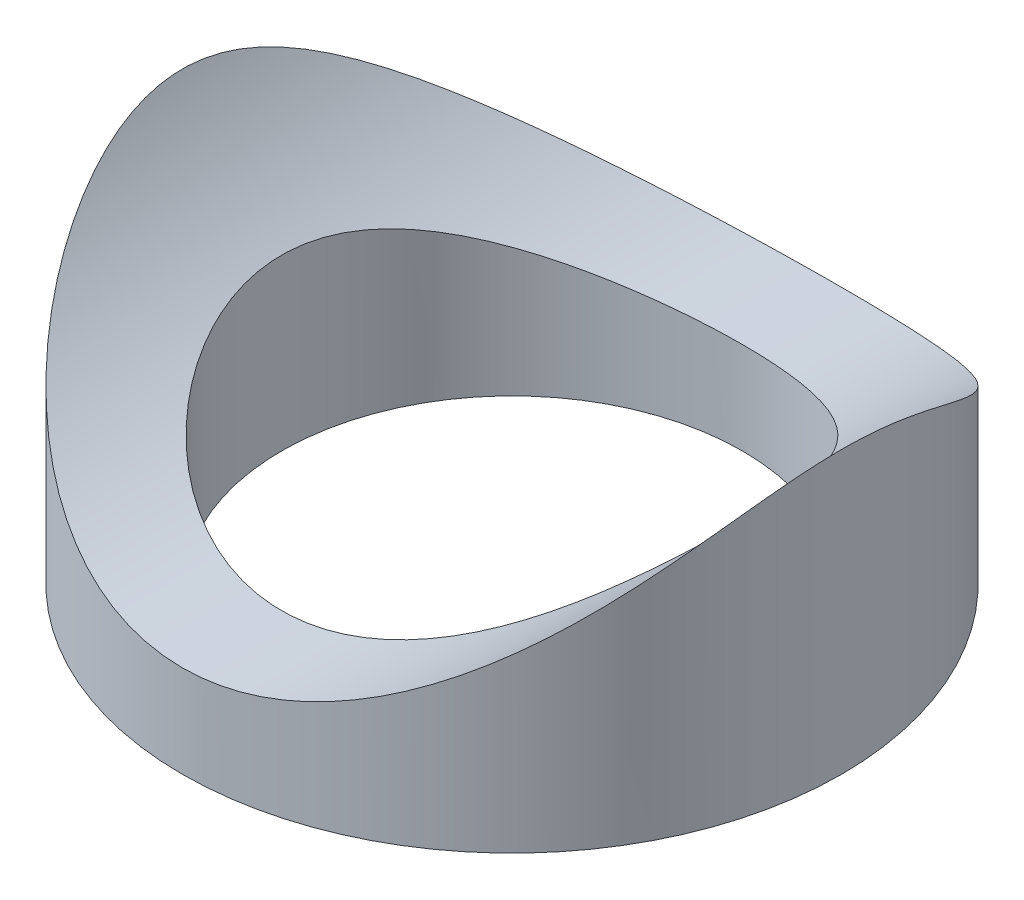
from build123d import *

# Parameters (mm, degrees)
SKETCH1_R               = 7.15
SKETCH1_R_2             = 5
BOSS_EXTRUDE1_DEPTH     = 10
CUT_EXTRUDE1_DEPTH      = 15.221286862
CUT_EXTRUDE1_DEPTH_BACK = 15.221286862
SKETCH2_R               = 8.28
BOSS_EXTRUDE2_START     = 1
SKETCH3_R               = 7.15
SKETCH3_R_2             = 5
BOSS_EXTRUDE2_DEPTH     = 1


with BuildPart() as part:
    # Sketch1 → Boss-Extrude1 (new body)
    with BuildSketch(Plane(origin=(0, 0, 0), x_dir=(1, 0, 0), z_dir=(0, 1, 0))):
        with Locations(Location((0, 0, 0), (0, 0, 270))):
            Circle(SKETCH1_R)
        with Locations(Location((0, 0, 0), (0, 0, 270))):
            Circle(SKETCH1_R_2, mode=Mode.SUBTRACT)
    extrude(amount=BOSS_EXTRUDE1_DEPTH)

    # Sketch2 → Cut-Extrude1 (cut, two sides: drawn at the far end of the back side and taken through both)
    with BuildSketch(Plane.XY.offset(-CUT_EXTRUDE1_DEPTH_BACK)):
        with Locations((0, 9.28)):
            Circle(SKETCH2_R)
    extrude(amount=CUT_EXTRUDE1_DEPTH + CUT_EXTRUDE1_DEPTH_BACK, mode=Mode.SUBTRACT)

    # Sketch3 → Boss-Extrude2 (add)
    with BuildSketch(Plane.XZ.offset(BOSS_EXTRUDE2_START)):
        with Locations(Location((0, 0, 0), (0, 0, 270))):
            Circle(SKETCH3_R)
        with Locations(Location((0, 0, 0), (0, 0, 270))):
            Circle(SKETCH3_R_2, mode=Mode.SUBTRACT)
    extrude(amount=-BOSS_EXTRUDE2_DEPTH)


solid = part.part
